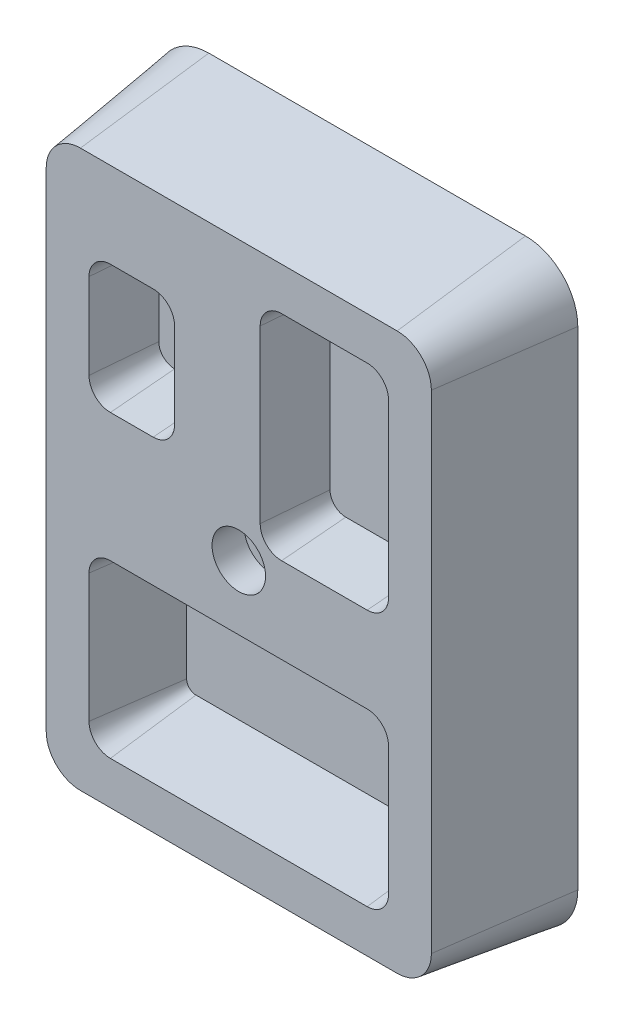
from build123d import *

# Parameters (mm, degrees)
BOSS_EXTRUDE1_DEPTH                              = 38.1
BOSS_EXTRUDE1_DRAFT                              = 8
CUT_EXTRUDE1_DEPTH                               = 19.05
CUT_EXTRUDE1_DRAFT                               = -5
CUT_EXTRUDE1_PROFILE_2_DEPTH                     = 19.05
CUT_EXTRUDE1_PROFILE_2_DRAFT                     = -5
CUT_EXTRUDE2_DEPTH                               = 25.4
CUT_EXTRUDE2_DRAFT                               = -8
CBORE_FOR_3_8_SOCKET_HEAD_CAP_SCREW1_D           = 10.3124
CBORE_FOR_3_8_SOCKET_HEAD_CAP_SCREW1_CBORE_D     = 15.875
CBORE_FOR_3_8_SOCKET_HEAD_CAP_SCREW1_CBORE_DEPTH = 9.525


with BuildPart() as part:
    # Sketch1 → Boss-Extrude1 (with draft: the straight prism first)
    with BuildSketch(Plane(origin=(0, 0, 0), x_dir=(0, 1, 0), z_dir=(0, 0, 1))):
        with BuildLine():
            ThreePointArc((-72.39, 57.15), (-79.574204897, 54.174204897), (-82.55, 46.99))
            Line((-82.55, 46.99), (-82.55, -46.99))
            ThreePointArc((-82.55, -46.99), (-79.574204897, -54.174204897), (-72.39, -57.15))
            Line((-72.39, -57.15), (72.39, -57.15))
            ThreePointArc((72.39, -57.15), (79.574204897, -54.174204897), (82.55, -46.99))
            Line((82.55, -46.99), (82.55, 46.99))
            ThreePointArc((82.55, 46.99), (79.574204897, 54.174204897), (72.39, 57.15))
            Line((72.39, 57.15), (-72.39, 57.15))
        make_face()
    extrude(amount=-BOSS_EXTRUDE1_DEPTH)
    # Boss-Extrude1: the draft: its side faces are tilted about the plane it starts from
    boss_extrude1_sides = [part.faces().sort_by_distance(p)[0] for p in [
        (-57.15, 0, -19.05),
        (-54.174204897, -79.574204897, -19.05),
        (0, -82.55, -19.05),
        (54.174204897, -79.574204897, -19.05),
        (57.15, 0, -19.05),
        (54.174204897, 79.574204897, -19.05),
        (0, 82.55, -19.05),
        (-54.174204897, 79.574204897, -19.05),
    ]]
    draft(boss_extrude1_sides, Plane(origin=(0, 0, 0), x_dir=(0, 1, 0), z_dir=(0, 0, 1)), BOSS_EXTRUDE1_DRAFT)


with BuildPart() as cut_extrude1_tool:
    # Sketch4 → Cut-Extrude1 (with draft: the straight prism first)
    with BuildSketch(Plane(origin=(0, 0, 0), x_dir=(0, 1, 0), z_dir=(0, 0, 1))):
        with BuildLine():
            Line((50.8, 44.45), (25.4, 44.45))
            ThreePointArc((25.4, 44.45), (20.909871939, 42.590128061), (19.05, 38.1))
            Line((19.05, 38.1), (19.05, 25.4))
            ThreePointArc((19.05, 25.4), (20.909871939, 20.909871939), (25.4, 19.05))
            Line((25.4, 19.05), (50.8, 19.05))
            ThreePointArc((50.8, 19.05), (55.290128061, 20.909871939), (57.15, 25.4))
            Line((57.15, 25.4), (57.15, 38.1))
            ThreePointArc((57.15, 38.1), (55.290128061, 42.590128061), (50.8, 44.45))
        make_face()
    extrude(amount=-CUT_EXTRUDE1_DEPTH)
    # Cut-Extrude1: the draft: its side faces are tilted about the plane it starts from
    cut_extrude1_sides = [cut_extrude1_tool.faces().sort_by_distance(p)[0] for p in [
        (-44.45, 38.1, -9.525),
        (-42.590128061, 20.909871939, -9.525),
        (-31.75, 19.05, -9.525),
        (-20.909871939, 20.909871939, -9.525),
        (-19.05, 38.1, -9.525),
        (-20.909871939, 55.290128061, -9.525),
        (-31.75, 57.15, -9.525),
        (-42.590128061, 55.290128061, -9.525),
    ]]
    draft(cut_extrude1_sides, Plane(origin=(0, 0, 0), x_dir=(0, 1, 0), z_dir=(0, 0, 1)), CUT_EXTRUDE1_DRAFT)


with BuildPart() as part_1:
    add(part.part)

    # Cut-Extrude1: cut by cut_extrude1_tool
    add(cut_extrude1_tool.part, mode=Mode.SUBTRACT)


with BuildPart() as cut_extrude1_profile_2_tool:
    # Sketch4 → Cut-Extrude1 profile 2 (with draft: the straight prism first)
    with BuildSketch(Plane(origin=(0, 0, 0), x_dir=(0, 1, 0), z_dir=(0, 0, 1))):
        with BuildLine():
            Line((63.5, -6.35), (12.7, -6.35))
            ThreePointArc((12.7, -6.35), (8.209871939, -8.209871939), (6.35, -12.7))
            Line((6.35, -12.7), (6.35, -38.1))
            ThreePointArc((6.35, -38.1), (8.209871939, -42.590128061), (12.7, -44.45))
            Line((12.7, -44.45), (63.5, -44.45))
            ThreePointArc((63.5, -44.45), (67.990128061, -42.590128061), (69.85, -38.1))
            Line((69.85, -38.1), (69.85, -12.7))
            ThreePointArc((69.85, -12.7), (67.990128061, -8.209871939), (63.5, -6.35))
        make_face()
    extrude(amount=-CUT_EXTRUDE1_PROFILE_2_DEPTH)
    # Cut-Extrude1 profile 2: the draft: its side faces are tilted about the plane it starts from
    cut_extrude1_profile_2_sides = [cut_extrude1_profile_2_tool.faces().sort_by_distance(p)[0] for p in [
        (6.35, 38.1, -9.525),
        (8.209871939, 8.209871939, -9.525),
        (25.4, 6.35, -9.525),
        (42.590128061, 8.209871939, -9.525),
        (44.45, 38.1, -9.525),
        (42.590128061, 67.990128061, -9.525),
        (25.4, 69.85, -9.525),
        (8.209871939, 67.990128061, -9.525),
    ]]
    draft(cut_extrude1_profile_2_sides, Plane(origin=(0, 0, 0), x_dir=(0, 1, 0), z_dir=(0, 0, 1)), CUT_EXTRUDE1_PROFILE_2_DRAFT)


with BuildPart() as part_2:
    add(part_1.part)

    # Cut-Extrude1 profile 2: cut by cut_extrude1_profile_2_tool
    add(cut_extrude1_profile_2_tool.part, mode=Mode.SUBTRACT)


with BuildPart() as cut_extrude2_tool:
    # Sketch4<3> → Cut-Extrude2 (with draft: the straight prism first)
    with BuildSketch(Plane(origin=(0, 0, 0), x_dir=(0, 1, 0), z_dir=(0, 0, 1))):
        with BuildLine():
            Line((-25.4, 44.45), (-63.5, 44.45))
            ThreePointArc((-63.5, 44.45), (-67.990128061, 42.590128061), (-69.85, 38.1))
            Line((-69.85, 38.1), (-69.85, -38.1))
            ThreePointArc((-69.85, -38.1), (-67.990128061, -42.590128061), (-63.5, -44.45))
            Line((-63.5, -44.45), (-25.4, -44.45))
            ThreePointArc((-25.4, -44.45), (-20.909871939, -42.590128061), (-19.05, -38.1))
            Line((-19.05, -38.1), (-19.05, 38.1))
            ThreePointArc((-19.05, 38.1), (-20.909871939, 42.590128061), (-25.4, 44.45))
        make_face()
    extrude(amount=-CUT_EXTRUDE2_DEPTH)
    # Cut-Extrude2: the draft: its side faces are tilted about the plane it starts from
    cut_extrude2_sides = [cut_extrude2_tool.faces().sort_by_distance(p)[0] for p in [
        (-42.590128061, -20.909871939, -12.7),
        (-44.45, -44.45, -12.7),
        (-42.590128061, -67.990128061, -12.7),
        (0, -69.85, -12.7),
        (42.590128061, -67.990128061, -12.7),
        (44.45, -44.45, -12.7),
        (42.590128061, -20.909871939, -12.7),
        (0, -19.05, -12.7),
    ]]
    draft(cut_extrude2_sides, Plane(origin=(0, 0, 0), x_dir=(0, 1, 0), z_dir=(0, 0, 1)), CUT_EXTRUDE2_DRAFT)


with BuildPart() as part_3:
    add(part_2.part)

    # Cut-Extrude2: cut by cut_extrude2_tool
    add(cut_extrude2_tool.part, mode=Mode.SUBTRACT)

    # CBORE for 3/8 Socket Head Cap Screw1 (through all)
    with Locations(Plane(origin=(0, 0, 0), x_dir=(0, -1, 0), z_dir=(0, 0, 1))):
        with Locations((0, 0)):
            CounterBoreHole(CBORE_FOR_3_8_SOCKET_HEAD_CAP_SCREW1_D / 2, CBORE_FOR_3_8_SOCKET_HEAD_CAP_SCREW1_CBORE_D / 2, CBORE_FOR_3_8_SOCKET_HEAD_CAP_SCREW1_CBORE_DEPTH)


solid = part_3.part
